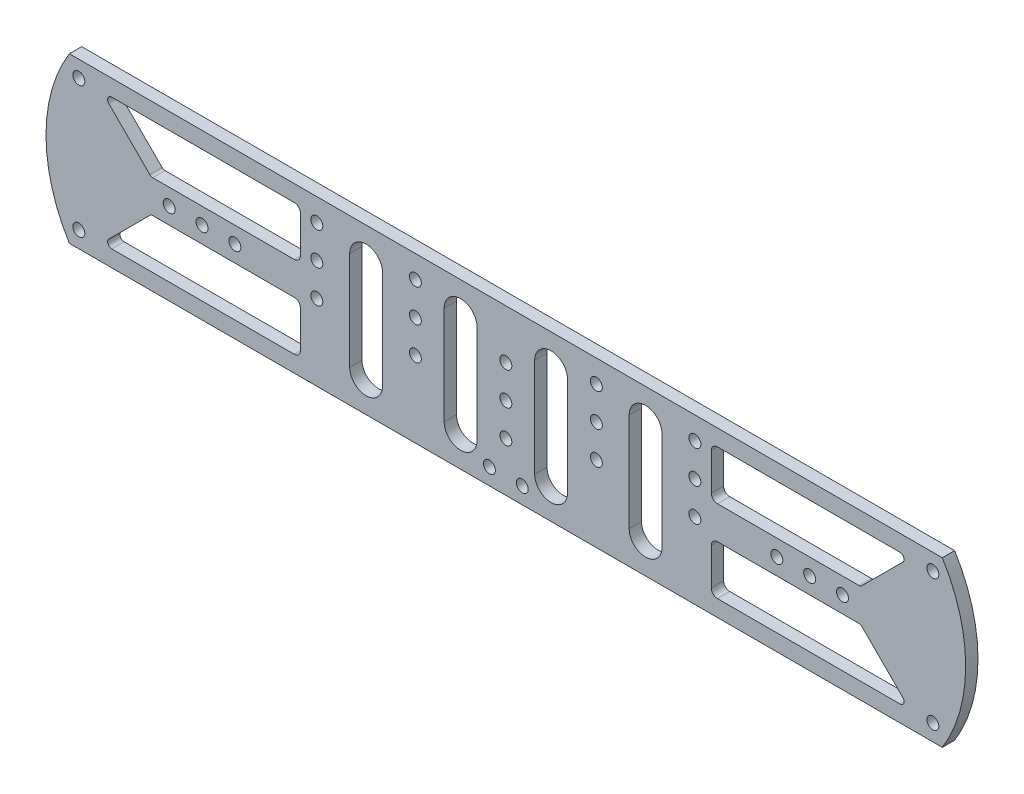
from build123d import *

# Parameters (mm, degrees)
SKETCH1_R                   = 2.3114
BOSS_EXTRUDE1_DEPTH         = 4.7625
F_14_0_182_DIAMETER_HOLE1_D = 4.6228
WEIGHTCUTTING_2_DEPTH       = 189.859131117
WEIGHTCUTTING_2_DEPTH_BACK  = 189.859131117
CUT_EXTRUDE1_DEPTH          = 189.859131117


with BuildPart() as part:
    # Sketch1 → Boss-Extrude1 (new body)
    with BuildSketch(Plane.XY):
        with BuildLine():
            Line((-168.768694788, 0), (168.768694788, 0))
            ThreePointArc((168.768694788, 0), (177.8, 31.75), (168.768694788, 63.5))
            Line((168.768694788, 63.5), (-168.768694788, 63.5))
            ThreePointArc((-168.768694788, 63.5), (-177.8, 31.75), (-168.768694788, 0))
        make_face()
        with Locations(Location((-117.475, 31.75, 0), (0, 0, 180))):
            Circle(SKETCH1_R, mode=Mode.SUBTRACT)
        with Locations(Location((117.475, 31.75, 0), (0, 0, 180))):
            Circle(SKETCH1_R, mode=Mode.SUBTRACT)
        with Locations(Location((-130.175, 31.75, 0), (0, 0, 180))):
            Circle(SKETCH1_R, mode=Mode.SUBTRACT)
        with Locations(Location((-104.775, 31.75, 0), (0, 0, 180))):
            Circle(SKETCH1_R, mode=Mode.SUBTRACT)
        with Locations(Location((104.775, 31.75, 0), (0, 0, 180))):
            Circle(SKETCH1_R, mode=Mode.SUBTRACT)
        with Locations(Location((130.175, 31.75, 0), (0, 0, 180))):
            Circle(SKETCH1_R, mode=Mode.SUBTRACT)
        with Locations(Location((-165.1, 57.15, 0), (0, 0, 180))):
            Circle(SKETCH1_R, mode=Mode.SUBTRACT)
        with Locations(Location((-165.1, 6.35, 0), (0, 0, 180))):
            Circle(SKETCH1_R, mode=Mode.SUBTRACT)
        with Locations(Location((165.1, 6.35, 0), (0, 0, 180))):
            Circle(SKETCH1_R, mode=Mode.SUBTRACT)
        with Locations(Location((165.1, 57.15, 0), (0, 0, 180))):
            Circle(SKETCH1_R, mode=Mode.SUBTRACT)
    extrude(amount=BOSS_EXTRUDE1_DEPTH)

    # #14 (0.182) Diameter Hole1 (through all)
    with Locations(Plane.XY.offset(4.7625)):
        with Locations((-73.088746639, 54.770291494), (-73.088746639, 42.070291494), (-73.088746639, 29.370291494), (-34.988746639, 29.370291494), (-34.988746639, 42.070291494), (-34.988746639, 54.770291494), (34.988746639, 54.770291494), (34.988746639, 42.070291494), (34.988746639, 29.370291494), (73.088746639, 29.370291494), (73.088746639, 42.070291494), (73.088746639, 54.770291494), (0, 44.45), (0, 31.75), (0, 19.05), (-6.35, 6.35), (6.35, 6.35)):
            Hole(F_14_0_182_DIAMETER_HOLE1_D / 2)

    # Sketch7 → WeightCutting_2 (cut, two sides: drawn at the far end of the back side and taken through both)
    with BuildSketch(Plane.XY.offset(4.7625).offset(-WEIGHTCUTTING_2_DEPTH_BACK)):
        with BuildLine():
            Line((-153.521805348, 54.441722315), (-137.644750023, 38.564666989))
            ThreePointArc((-137.644750023, 38.564666989), (-137.130061354, 38.220763016), (-136.522944675, 38.1))
            Line((-136.522944675, 38.1), (-81.818455145, 38.1))
            ThreePointArc((-81.818455145, 38.1), (-80.135747123, 38.797000484), (-79.438746639, 40.479708506))
            Line((-79.438746639, 40.479708506), (-79.438746639, 54.770291494))
            ThreePointArc((-79.438746639, 54.770291494), (-80.135747123, 56.452999516), (-81.818455145, 57.15))
            Line((-81.818455145, 57.15), (-152.4, 57.15))
            ThreePointArc((-152.4, 57.15), (-153.865709321, 56.170644342), (-153.521805348, 54.441722315))
        make_face()
        with BuildLine():
            Line((81.818455145, 57.15), (152.4, 57.15))
            ThreePointArc((152.4, 57.15), (153.865709321, 56.170644342), (153.521805348, 54.441722315))
            Line((153.521805348, 54.441722315), (137.644750023, 38.564666989))
            ThreePointArc((137.644750023, 38.564666989), (137.130061354, 38.220763016), (136.522944675, 38.1))
            Line((136.522944675, 38.1), (81.818455145, 38.1))
            ThreePointArc((81.818455145, 38.1), (80.135747123, 38.797000484), (79.438746639, 40.479708506))
            Line((79.438746639, 40.479708506), (79.438746639, 54.770291494))
            ThreePointArc((79.438746639, 54.770291494), (80.135747123, 56.452999516), (81.818455145, 57.15))
        make_face()
        with BuildLine():
            Line((-81.818455145, 6.35), (-152.4, 6.35))
            ThreePointArc((-152.4, 6.35), (-153.865709321, 7.329355658), (-153.521805348, 9.058277685))
            Line((-153.521805348, 9.058277685), (-137.644750023, 24.935333011))
            ThreePointArc((-137.644750023, 24.935333011), (-137.130061354, 25.279236984), (-136.522944675, 25.4))
            Line((-136.522944675, 25.4), (-81.818455145, 25.4))
            ThreePointArc((-81.818455145, 25.4), (-80.135747123, 24.702999516), (-79.438746639, 23.020291494))
            Line((-79.438746639, 23.020291494), (-79.438746639, 8.729708506))
            ThreePointArc((-79.438746639, 8.729708506), (-80.135747123, 7.047000484), (-81.818455145, 6.35))
        make_face()
        with BuildLine():
            Line((79.438746639, 23.020291494), (79.438746639, 8.729708506))
            ThreePointArc((79.438746639, 8.729708506), (80.135747123, 7.047000484), (81.818455145, 6.35))
            Line((81.818455145, 6.35), (152.4, 6.35))
            ThreePointArc((152.4, 6.35), (153.865709321, 7.329355658), (153.521805348, 9.058277685))
            Line((153.521805348, 9.058277685), (137.644750023, 24.935333011))
            ThreePointArc((137.644750023, 24.935333011), (137.130061354, 25.279236984), (136.522944675, 25.4))
            Line((136.522944675, 25.4), (81.818455145, 25.4))
            ThreePointArc((81.818455145, 25.4), (80.135747123, 24.702999516), (79.438746639, 23.020291494))
        make_face()
    extrude(amount=WEIGHTCUTTING_2_DEPTH + WEIGHTCUTTING_2_DEPTH_BACK, mode=Mode.SUBTRACT)

    # Sketch9 → Cut-Extrude1 (cut, through all)
    with BuildSketch(Plane.XY.offset(4.7625)):
        with BuildLine():
            Line((-47.688746639, 50.8), (-47.688746639, 12.7))
            ThreePointArc((-47.688746639, 12.7), (-54.038746639, 6.35), (-60.388746639, 12.7))
            Line((-60.388746639, 12.7), (-60.388746639, 50.8))
            ThreePointArc((-60.388746639, 50.8), (-54.038746639, 57.15), (-47.688746639, 50.8))
        make_face()
        with BuildLine():
            Line((60.388746639, 50.8), (60.388746639, 12.7))
            ThreePointArc((60.388746639, 12.7), (54.038746639, 6.35), (47.688746639, 12.7))
            Line((47.688746639, 12.7), (47.688746639, 50.8))
            ThreePointArc((47.688746639, 50.8), (54.038746639, 57.15), (60.388746639, 50.8))
        make_face()
        with BuildLine():
            Line((23.84437332, 50.8), (23.84437332, 12.7))
            ThreePointArc((23.84437332, 12.7), (17.49437332, 6.35), (11.14437332, 12.7))
            Line((11.14437332, 12.7), (11.14437332, 50.8))
            ThreePointArc((11.14437332, 50.8), (17.49437332, 57.15), (23.84437332, 50.8))
        make_face()
        with BuildLine():
            Line((-11.14437332, 50.8), (-11.14437332, 12.7))
            ThreePointArc((-11.14437332, 12.7), (-17.49437332, 6.35), (-23.84437332, 12.7))
            Line((-23.84437332, 12.7), (-23.84437332, 50.8))
            ThreePointArc((-23.84437332, 50.8), (-17.49437332, 57.15), (-11.14437332, 50.8))
        make_face()
    extrude(amount=-CUT_EXTRUDE1_DEPTH, mode=Mode.SUBTRACT)


solid = part.part
